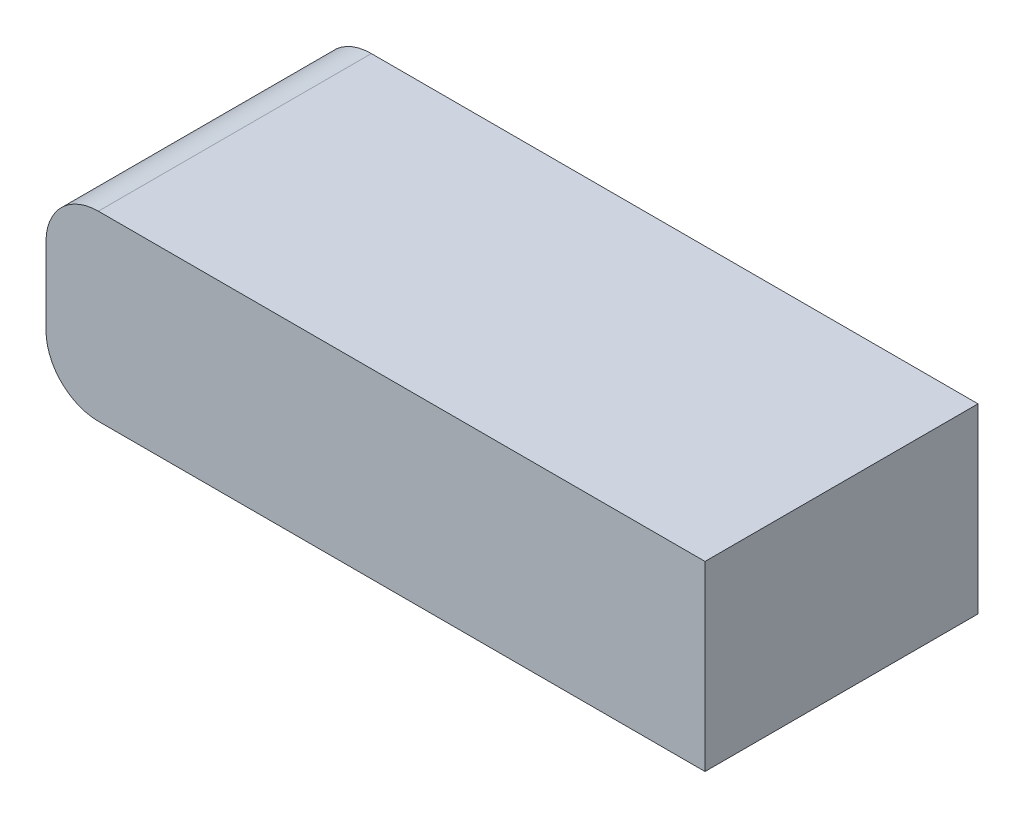
from build123d import *

# Parameters (mm, degrees)
AUFSATZ_LINEAR_AUSTRAGEN1_DEPTH = 160


with BuildPart() as part:
    # Skizze1 → Aufsatz-Linear austragen1 (new body)
    with BuildSketch(Plane.XY):
        with BuildLine():
            Line((0, 0), (355.55555, 0))
            Line((355.55555, 0), (355.55555, 106.666))
            Line((355.55555, 106.666), (0, 106.666))
            ThreePointArc((0, 106.666), (-21.710167252, 97.673354283), (-30.702812969, 75.963187031))
            Line((-30.702812969, 75.963187031), (-30.702812969, 30.702812969))
            ThreePointArc((-30.702812969, 30.702812969), (-21.710167252, 8.992645717), (0, 0))
        make_face()
    extrude(amount=AUFSATZ_LINEAR_AUSTRAGEN1_DEPTH)


solid = part.part
